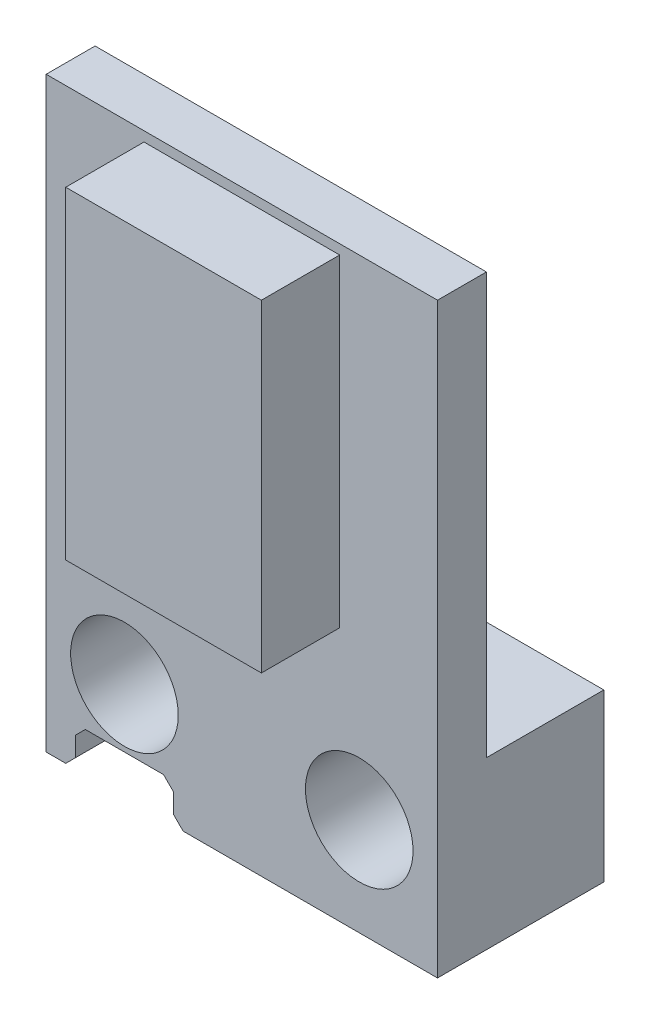
from build123d import *

# Parameters (mm, degrees)
SKETCH_1_W          = 40
SKETCH_1_H          = 60
EXTRUDE_1_DEPTH     = 5
SKETCH_2_W          = 40
SKETCH_2_H          = 17
EXTRUDE_2_DEPTH     = 12
SKETCH_3_R          = 5.5
CUT_EXTRUDE_1_DEPTH = 15
SKETCH_4_R          = 3
CUT_EXTRUDE_2_DEPTH = 10
SKETCH_7_W          = 20
SKETCH_7_H          = 33
EXTRUDE_4_DEPTH     = 8
SKETCH_8_W          = 10
SKETCH_8_H          = 30
CUT_EXTRUDE_3_DEPTH = 10
SKETCH_9_W          = 10
SKETCH_9_H          = 4
CUT_EXTRUDE_4_DEPTH = 10
SKETCH_10_W         = 10
SKETCH_10_H         = 4
CUT_EXTRUDE_5_DEPTH = 25
CHAMFER_1_SIZE      = 1


with BuildPart() as part:
    # 草图1 → 凸台-拉伸1 (new body)
    with BuildSketch(Plane.XY):
        Rectangle(SKETCH_1_W, SKETCH_1_H)
    extrude(amount=EXTRUDE_1_DEPTH)

    # 草图2 → 凸台-拉伸2 (add)
    with BuildSketch(Plane(origin=(0, 0, 0), x_dir=(-1, 0, 0), z_dir=(0, 0, -1))):
        with Locations((0, -21.5)):
            Rectangle(SKETCH_2_W, SKETCH_2_H)
    extrude(amount=EXTRUDE_2_DEPTH)

    # 草图3 → 切除-拉伸1 (cut)
    with BuildSketch(Plane.XY.offset(5)):
        with Locations((-12, -20)):
            Circle(SKETCH_3_R)
        with Locations((12, -20)):
            Circle(SKETCH_3_R)
    extrude(amount=-CUT_EXTRUDE_1_DEPTH, mode=Mode.SUBTRACT)

    # 草图4 → 切除-拉伸2 (cut)
    with BuildSketch(Plane.XY.offset(-10)):
        with Locations((-12, -20)):
            Circle(SKETCH_4_R)
        with Locations((12, -20)):
            Circle(SKETCH_4_R)
    extrude(amount=-CUT_EXTRUDE_2_DEPTH, mode=Mode.SUBTRACT)

    # 草图7 → 凸台-拉伸4 (add)
    with BuildSketch(Plane.XY.offset(5)):
        with Locations((0, 12.5)):
            Rectangle(SKETCH_7_W, SKETCH_7_H)
    extrude(amount=EXTRUDE_4_DEPTH)

    # 草图8 → 切除-拉伸3 (cut)
    with BuildSketch(Plane(origin=(0, 0, 0), x_dir=(-1, 0, 0), z_dir=(0, 0, -1))):
        with Locations((0, 12)):
            Rectangle(SKETCH_8_W, SKETCH_8_H)
    extrude(amount=-CUT_EXTRUDE_3_DEPTH, mode=Mode.SUBTRACT)

    # 草图9 → 切除-拉伸4 (cut)
    with BuildSketch(Plane.XZ.offset(4)):
        with Locations((0, 7)):
            Rectangle(SKETCH_9_W, SKETCH_9_H)
    extrude(amount=-CUT_EXTRUDE_4_DEPTH, mode=Mode.SUBTRACT)

    # 草图10 → 切除-拉伸5 (cut)
    with BuildSketch(Plane.XY.offset(5)):
        with Locations((-12, -28)):
            Rectangle(SKETCH_10_W, SKETCH_10_H)
    extrude(amount=-CUT_EXTRUDE_5_DEPTH, mode=Mode.SUBTRACT)

    # 倒角1
    chamfer_1_edges = [part.edges().sort_by_distance(p)[0] for p in [
        (-17, -30, -3.5),
        (-17, -26, -3.5),
        (-7, -26, -3.5),
        (-7, -30, -3.5),
    ]]
    chamfer(chamfer_1_edges, length=CHAMFER_1_SIZE)


solid = part.part
